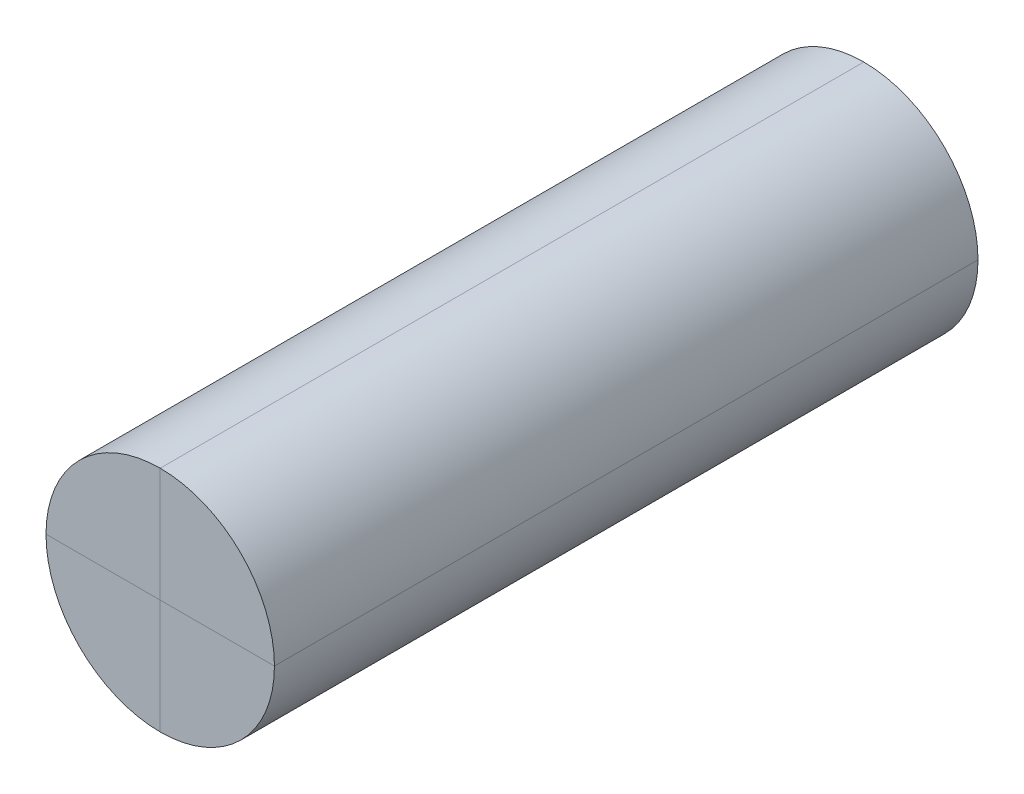
from build123d import *

# Parameters (mm, degrees)
SKETCH1_R      = 3.81
EXTRUDE1_DEPTH = 23.47


with BuildPart() as part:
    # Sketch1 → Extrude1 (new body)
    with BuildSketch(Plane.XY):
        Circle(SKETCH1_R)
    extrude(amount=EXTRUDE1_DEPTH)


solid = part.part
